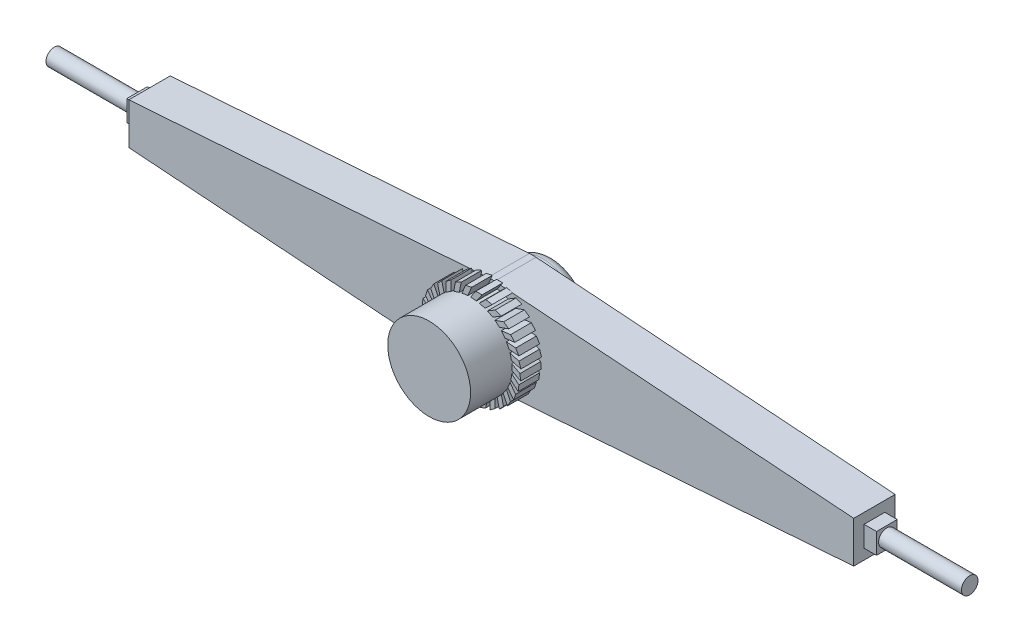
from build123d import *

# Parameters (mm, degrees)
BOSS_EXTRUDE1_DEPTH = 10
SKETCH2_R           = 20
BOSS_EXTRUDE2_DEPTH = 30
SKETCH3_R           = 18.5
BOSS_EXTRUDE3_DEPTH = 10
FILLET1_R           = 5
SKETCH4_W           = 10
SKETCH4_H           = 10
BOSS_EXTRUDE4_DEPTH = 6
SKETCH5_R           = 4
BOSS_EXTRUDE5_DEPTH = 40
BOSS_EXTRUDE6_DEPTH = 10


with BuildPart() as part:
    # Sketch1 → Boss-Extrude1 (new, symmetric)
    with BuildSketch(Plane.XY):
        with BuildLine():
            Line((-175, -10), (-175, 10))
            Line((-175, 10), (-1.610440443, 22.442292253))
            ThreePointArc((-1.610440443, 22.442292253), (0, 22.5), (1.610440443, 22.442292253))
            Line((1.610440443, 22.442292253), (175, 10))
            Line((175, 10), (175, -10))
            Line((175, -10), (1.610440443, -22.442292253))
            ThreePointArc((1.610440443, -22.442292253), (0, -22.5), (-1.610440443, -22.442292253))
            Line((-1.610440443, -22.442292253), (-175, -10))
        make_face()
    extrude(amount=BOSS_EXTRUDE1_DEPTH, both=True)

    # Sketch2 → Boss-Extrude2 (add)
    with BuildSketch(Plane.XY.offset(10)):
        Circle(SKETCH2_R)
    extrude(amount=BOSS_EXTRUDE2_DEPTH)

    # Sketch3 → Boss-Extrude3 (add)
    with BuildSketch(Plane(origin=(0, 0, -10), x_dir=(-1, 0, 0), z_dir=(0, 0, -1))):
        with Locations(Location((0, 0, 0), (0, 0, 180))):
            Circle(SKETCH3_R)
    extrude(amount=BOSS_EXTRUDE3_DEPTH)

    # Fillet1
    fillet1_edges = [part.edges().sort_by_distance(p)[0] for p in [
        (-18.5, 0, -20),
    ]]
    fillet(fillet1_edges, radius=FILLET1_R)

    # Sketch4 → Boss-Extrude4 (add)
    with BuildSketch(Plane(origin=(175, 0, 0), x_dir=(0, 0, -1), z_dir=(1, 0, 0))):
        Rectangle(SKETCH4_W, SKETCH4_H)
    boss_extrude4 = extrude(amount=BOSS_EXTRUDE4_DEPTH)

    # Sketch5 → Boss-Extrude5 (add)
    with BuildSketch(Plane(origin=(181, 0, 0), x_dir=(0, 0, -1), z_dir=(1, 0, 0))):
        Circle(SKETCH5_R)
    boss_extrude5 = extrude(amount=BOSS_EXTRUDE5_DEPTH)

    # Mirror1: Boss-Extrude4, Boss-Extrude5 across plane
    add(boss_extrude4.mirror(Plane(origin=(0, 0, 0), x_dir=(0, 0, 1), z_dir=(1, 0, 0))))
    add(boss_extrude5.mirror(Plane(origin=(0, 0, 0), x_dir=(0, 0, 1), z_dir=(1, 0, 0))))

    # Sketch6 → Boss-Extrude6 (add)
    with BuildSketch(Plane.XY.offset(10)):
        with BuildLine():
            Line((0, -20), (-2.552063431, -23.706342165))
            Line((-2.552063431, -23.706342165), (-5.552063431, -23.706342165))
            Line((-5.552063431, -23.706342165), (-2.858606346, -19.79465508))
            ThreePointArc((-2.858606346, -19.79465508), (-1.432986111, -19.948597715), (0, -20))
        make_face()
        with BuildLine():
            Line((-10.359563207, -22.033962815), (-6.911679146, -18.767756695))
            ThreePointArc((-6.911679146, -18.767756695), (-5.549218607, -19.214738428), (-4.158233816, -19.562952015))
            Line((-4.158233816, -19.562952015), (-7.425120405, -22.657697888))
            Line((-7.425120405, -22.657697888), (-10.359563207, -22.033962815))
        make_face()
        with BuildLine():
            Line((-14.71430036, -19.39859356), (-10.662678401, -16.920617285))
            ThreePointArc((-10.662678401, -16.920617285), (-9.422923622, -17.641102869), (-8.134732862, -18.270909153))
            Line((-8.134732862, -18.270909153), (-11.973663987, -20.618803489))
            Line((-11.973663987, -20.618803489), (-14.71430036, -19.39859356))
        make_face()
        with BuildLine():
            Line((-18.42595198, -15.915412681), (-13.947667445, -14.333965705))
            ThreePointArc((-13.947667445, -14.333965705), (-12.884801658, -15.296466463), (-11.755705046, -16.180339887))
            Line((-11.755705046, -16.180339887), (-15.998900997, -17.678768438))
            Line((-15.998900997, -17.678768438), (-18.42595198, -15.915412681))
        make_face()
        with BuildLine():
            Line((-21.332301081, -11.736651898), (-16.623076493, -11.120851042))
            ThreePointArc((-16.623076493, -11.120851042), (-15.783552033, -12.283301072), (-14.86289651, -13.382612127))
            Line((-14.86289651, -13.382612127), (-19.324909262, -13.966086374))
            Line((-19.324909262, -13.966086374), (-21.332301081, -11.736651898))
        make_face()
        with BuildLine():
            Line((-23.306326261, -7.044943108), (-18.571977332, -7.421701825))
            ThreePointArc((-18.571977332, -7.421701825), (-17.992485447, -8.733296482), (-17.320508076, -10))
            Line((-17.320508076, -10), (-21.806326261, -9.643019319))
            Line((-21.806326261, -9.643019319), (-23.306326261, -7.044943108))
        make_face()
        with BuildLine():
            Line((-24.261753148, -2.045336498), (-19.709193643, -3.398188624))
            ThreePointArc((-19.709193643, -3.398188624), (-19.415060909, -4.801604929), (-19.021130326, -6.180339887))
            Line((-19.021130326, -6.180339887), (-23.334702164, -4.898506047))
            Line((-23.334702164, -4.898506047), (-24.261753148, -2.045336498))
        make_face()
        with BuildLine():
            Line((-24.156825, 3.043661131), (-19.985023617, 0.773841725))
            ThreePointArc((-19.985023617, 0.773841725), (-19.989105046, -0.6600602), (-19.890437907, -2.090569265))
            Line((-19.890437907, -2.090569265), (-23.843239611, 0.060095445))
            Line((-23.843239611, 0.060095445), (-24.156825, 3.043661131))
        make_face()
        with BuildLine():
            Line((-22.996127684, 7.999636163), (-19.38741216, 4.912051478))
            ThreePointArc((-19.38741216, 4.912051478), (-19.689529374, 3.510332327), (-19.890437907, 2.090569265))
            Line((-19.890437907, 2.090569265), (-23.309713073, 5.016070477))
            Line((-23.309713073, 5.016070477), (-22.996127684, 7.999636163))
        make_face()
        with BuildLine():
            Line((-20.830389239, 12.605988709), (-17.942477761, 8.835581011))
            ThreePointArc((-17.942477761, 8.835581011), (-18.529426787, 7.527306487), (-19.021130326, 6.180339887))
            Line((-19.021130326, 6.180339887), (-21.757440222, 9.75281916))
            Line((-21.757440222, 9.75281916), (-20.830389239, 12.605988709))
        make_face()
        with BuildLine():
            Line((-17.75426283, 16.661399057), (-15.713370986, 12.372953256))
            ThreePointArc((-15.713370986, 12.372953256), (-16.559499336, 11.215301233), (-17.320508076, 10))
            Line((-17.320508076, 10), (-19.25426283, 14.063322846))
            Line((-19.25426283, 14.063322846), (-17.75426283, 16.661399057))
        make_face()
        with BuildLine():
            Line((-13.902189941, 19.988626317), (-12.797514497, 15.369568071))
            ThreePointArc((-12.797514497, 15.369568071), (-13.865842302, 14.413133499), (-14.86289651, 13.382612127))
            Line((-14.86289651, 13.382612127), (-15.90958176, 17.759191841))
            Line((-15.90958176, 17.759191841), (-13.902189941, 19.988626317))
        make_face()
        with BuildLine():
            Line((-9.442524641, 22.442254691), (-9.322345216, 17.69445901))
            ThreePointArc((-9.322345216, 17.69445901), (-10.566181424, 16.981042669), (-11.755705046, 16.180339887))
            Line((-11.755705046, 16.180339887), (-11.869575624, 20.678898934))
            Line((-11.869575624, 20.678898934), (-9.442524641, 22.442254691))
        make_face()
        with BuildLine():
            Line((-4.570175704, 23.915048844), (-5.439744715, 19.246017184))
            ThreePointArc((-5.439744715, 19.246017184), (-6.804727716, 18.80679879), (-8.134732862, 18.270909153))
            Line((-8.134732862, 18.270909153), (-7.310812077, 22.694838915))
            Line((-7.310812077, 22.694838915), (-4.570175704, 23.915048844))
        make_face()
        with BuildLine():
            Line((0.501911842, 24.342640606), (-1.319401268, 19.956432053))
            ThreePointArc((-1.319401268, 19.956432053), (-2.745874754, 19.810607558), (-4.158233816, 19.562952015))
            Line((-4.158233816, 19.562952015), (-2.43253096, 23.718905534))
            Line((-2.43253096, 23.718905534), (0.501911842, 24.342640606))
        make_face()
        with BuildLine():
            Line((5.552063431, 23.706342165), (2.858606346, 19.79465508))
            ThreePointArc((2.858606346, 19.79465508), (1.432986111, 19.948597715), (0, 20))
            Line((0, 20), (2.552063431, 23.706342165))
            Line((2.552063431, 23.706342165), (5.552063431, 23.706342165))
        make_face()
        with BuildLine():
            Line((10.359563207, 22.033962815), (6.911679146, 18.767756695))
            ThreePointArc((6.911679146, 18.767756695), (5.549218607, 19.214738428), (4.158233816, 19.562952015))
            Line((4.158233816, 19.562952015), (7.425120405, 22.657697888))
            Line((7.425120405, 22.657697888), (10.359563207, 22.033962815))
        make_face()
        with BuildLine():
            Line((14.71430036, 19.39859356), (10.662678401, 16.920617285))
            ThreePointArc((10.662678401, 16.920617285), (9.422923622, 17.641102869), (8.134732862, 18.270909153))
            Line((8.134732862, 18.270909153), (11.973663987, 20.618803489))
            Line((11.973663987, 20.618803489), (14.71430036, 19.39859356))
        make_face()
        with BuildLine():
            Line((18.42595198, 15.915412681), (13.947667445, 14.333965705))
            ThreePointArc((13.947667445, 14.333965705), (12.884801658, 15.296466463), (11.755705046, 16.180339887))
            Line((11.755705046, 16.180339887), (15.998900997, 17.678768438))
            Line((15.998900997, 17.678768438), (18.42595198, 15.915412681))
        make_face()
        with BuildLine():
            Line((21.332301081, 11.736651898), (16.623076493, 11.120851042))
            ThreePointArc((16.623076493, 11.120851042), (15.783552033, 12.283301072), (14.86289651, 13.382612127))
            Line((14.86289651, 13.382612127), (19.324909262, 13.966086374))
            Line((19.324909262, 13.966086374), (21.332301081, 11.736651898))
        make_face()
        with BuildLine():
            Line((23.306326261, 7.044943108), (18.571977332, 7.421701825))
            ThreePointArc((18.571977332, 7.421701825), (17.992485447, 8.733296482), (17.320508076, 10))
            Line((17.320508076, 10), (21.806326261, 9.643019319))
            Line((21.806326261, 9.643019319), (23.306326261, 7.044943108))
        make_face()
        with BuildLine():
            Line((24.261753148, 2.045336498), (19.709193643, 3.398188624))
            ThreePointArc((19.709193643, 3.398188624), (19.415060909, 4.801604929), (19.021130326, 6.180339887))
            Line((19.021130326, 6.180339887), (23.334702164, 4.898506047))
            Line((23.334702164, 4.898506047), (24.261753148, 2.045336498))
        make_face()
        with BuildLine():
            Line((24.156825, -3.043661131), (19.985023617, -0.773841725))
            ThreePointArc((19.985023617, -0.773841725), (19.989105046, 0.6600602), (19.890437907, 2.090569265))
            Line((19.890437907, 2.090569265), (23.843239611, -0.060095445))
            Line((23.843239611, -0.060095445), (24.156825, -3.043661131))
        make_face()
        with BuildLine():
            Line((22.996127684, -7.999636163), (19.38741216, -4.912051478))
            ThreePointArc((19.38741216, -4.912051478), (19.689529374, -3.510332327), (19.890437907, -2.090569265))
            Line((19.890437907, -2.090569265), (23.309713073, -5.016070477))
            Line((23.309713073, -5.016070477), (22.996127684, -7.999636163))
        make_face()
        with BuildLine():
            Line((20.830389239, -12.605988709), (17.942477761, -8.835581011))
            ThreePointArc((17.942477761, -8.835581011), (18.529426787, -7.527306487), (19.021130326, -6.180339887))
            Line((19.021130326, -6.180339887), (21.757440222, -9.75281916))
            Line((21.757440222, -9.75281916), (20.830389239, -12.605988709))
        make_face()
        with BuildLine():
            Line((17.75426283, -16.661399057), (15.713370986, -12.372953256))
            ThreePointArc((15.713370986, -12.372953256), (16.559499336, -11.215301233), (17.320508076, -10))
            Line((17.320508076, -10), (19.25426283, -14.063322846))
            Line((19.25426283, -14.063322846), (17.75426283, -16.661399057))
        make_face()
        with BuildLine():
            Line((13.902189941, -19.988626317), (12.797514497, -15.369568071))
            ThreePointArc((12.797514497, -15.369568071), (13.865842302, -14.413133499), (14.86289651, -13.382612127))
            Line((14.86289651, -13.382612127), (15.90958176, -17.759191841))
            Line((15.90958176, -17.759191841), (13.902189941, -19.988626317))
        make_face()
        with BuildLine():
            Line((9.442524641, -22.442254691), (9.322345216, -17.69445901))
            ThreePointArc((9.322345216, -17.69445901), (10.566181424, -16.981042669), (11.755705046, -16.180339887))
            Line((11.755705046, -16.180339887), (11.869575624, -20.678898934))
            Line((11.869575624, -20.678898934), (9.442524641, -22.442254691))
        make_face()
        with BuildLine():
            Line((4.570175704, -23.915048844), (5.439744715, -19.246017184))
            ThreePointArc((5.439744715, -19.246017184), (6.804727716, -18.80679879), (8.134732862, -18.270909153))
            Line((8.134732862, -18.270909153), (7.310812077, -22.694838915))
            Line((7.310812077, -22.694838915), (4.570175704, -23.915048844))
        make_face()
        with BuildLine():
            Line((-0.501911842, -24.342640606), (1.319401268, -19.956432053))
            ThreePointArc((1.319401268, -19.956432053), (2.745874754, -19.810607558), (4.158233816, -19.562952015))
            Line((4.158233816, -19.562952015), (2.43253096, -23.718905534))
            Line((2.43253096, -23.718905534), (-0.501911842, -24.342640606))
        make_face()
    extrude(amount=BOSS_EXTRUDE6_DEPTH)


solid = part.part
